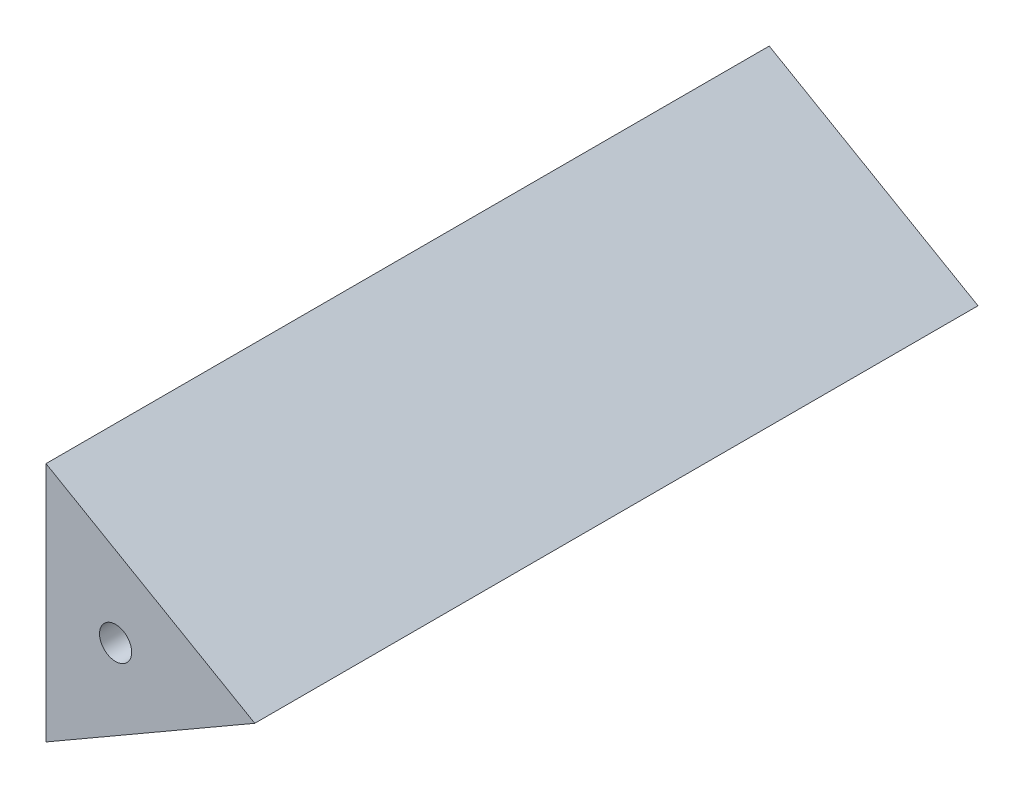
from build123d import *

# Parameters (mm, degrees)
SKETCH2_R           = 4
BOSS_EXTRUDE2_DEPTH = 180


with BuildPart() as part:
    # Sketch2 → Boss-Extrude2 (new body)
    with BuildSketch(Plane.XY):
        Polygon((34.64, 0), (-17.32, 29.999119987), (-17.32, -29.999119987), align=None)
        Circle(SKETCH2_R, mode=Mode.SUBTRACT)
    extrude(amount=BOSS_EXTRUDE2_DEPTH)


solid = part.part
